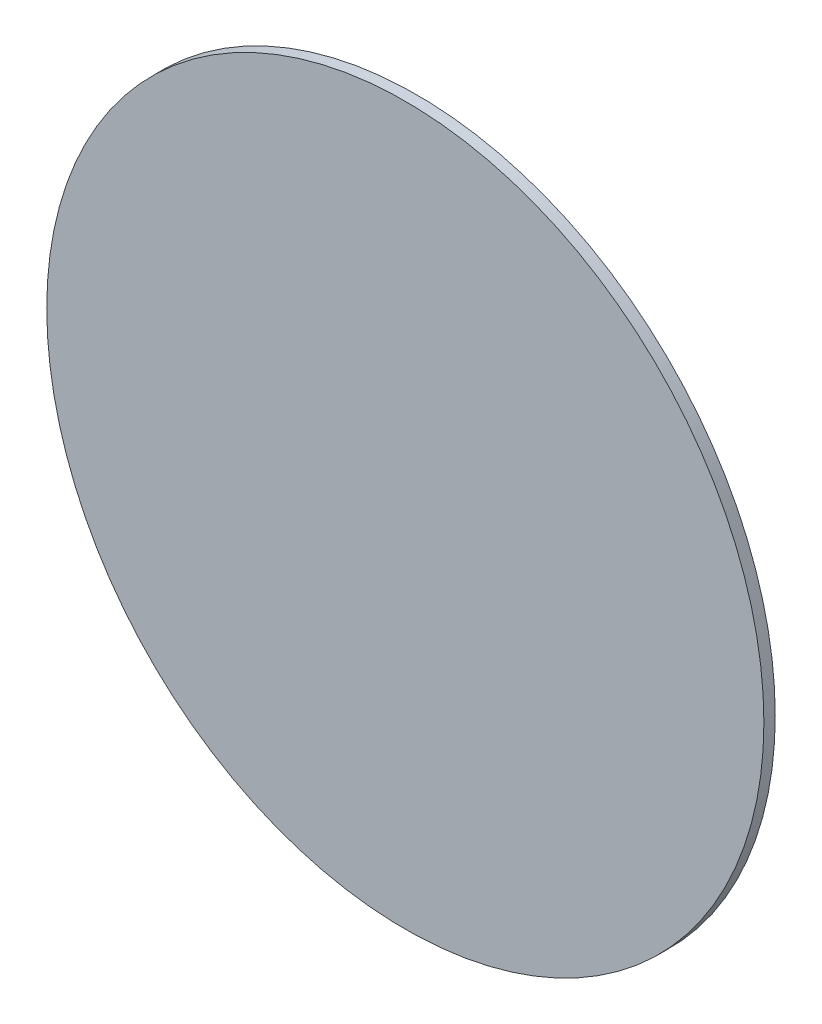
from build123d import *

# Parameters (mm, degrees)
END_LID_PROFILE_R      = 158
END_LID_DISC_5MM_DEPTH = 5


with BuildPart() as part:
    # End_Lid_Profile → End_Lid_Disc_5mm (new body)
    with BuildSketch(Plane.XY):
        Circle(END_LID_PROFILE_R)
    extrude(amount=END_LID_DISC_5MM_DEPTH)


solid = part.part
